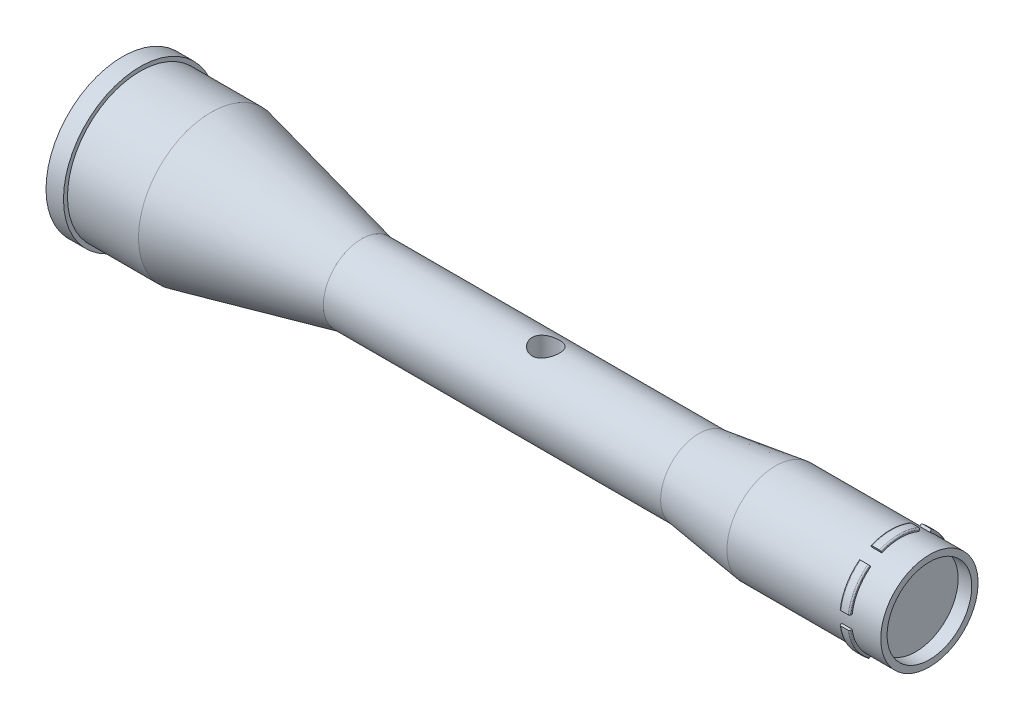
from build123d import *

# Parameters (mm, degrees)
BOSS_EXTRUDE1_DEPTH     = 3.73
FILLET1_R               = 0.5
FILLET2_R               = 0.5
FILLET3_R               = 0.5
FILLET4_R               = 0.5
FILLET5_R               = 0.5
FILLET6_R               = 0.5
CUT_EXTRUDE1_DEPTH      = 153.97340863692617
CUT_EXTRUDE1_DEPTH_BACK = 153.97340863692617
SKETCH3_R               = 5.000000000000001
SKETCH4_R               = 25.25
CUT_EXTRUDE2_DEPTH      = 5
SKETCH5_R               = 15.5
CUT_EXTRUDE3_DEPTH      = 5


with BuildPart() as part:
    # Sketch1 → Revolve1 (revolve)
    with BuildSketch(Plane(origin=(0, 0, 0), x_dir=(1, 0, 0), z_dir=(0, 1, 0)), mode=Mode.PRIVATE) as revolve1_sk:
        Polygon((-147.75, 0), (-147.75, 28.025), (-141.35, 28.025), (-141.35, 26.56), (-115.35000000000001, 26.56), (-60.19000000000001, 14), (63.309999999999974, 14.000000000000002), (91.40999999999998, 17.819999999999993), (147.75, 17.82), (147.75, 5.428e-14), align=None)
    revolve(revolve1_sk.sketch.rotate(Axis((-147.75, 0, 0), (1, 0, -1.8e-16)), 180), axis=Axis((-147.75, 0, 0), (1, 0, -1.8e-16)))

    # Sketch3 → Cut-Extrude1 (cut, two sides: drawn at the far end of the back side and taken through both)
    with BuildSketch(Plane(origin=(0, 0, 0), x_dir=(1, 0, 0), z_dir=(0, 1, 0)).offset(-CUT_EXTRUDE1_DEPTH_BACK)):
        with Locations(Location((7.269999999999978, 0, 0), (0, 0, 270))):
            Circle(SKETCH3_R)
    extrude(amount=CUT_EXTRUDE1_DEPTH + CUT_EXTRUDE1_DEPTH_BACK, mode=Mode.SUBTRACT)

    # Sketch4 → Cut-Extrude2 (cut)
    with BuildSketch(Plane.ZY.offset(147.75)):
        Circle(SKETCH4_R)
    extrude(amount=-CUT_EXTRUDE2_DEPTH, mode=Mode.SUBTRACT)

    # Sketch5 → Cut-Extrude3 (cut)
    with BuildSketch(Plane(origin=(147.75, 0, -2.714e-14), x_dir=(-1.8e-16, 0, -1), z_dir=(1, 0, -1.8e-16))):
        Circle(SKETCH5_R)
    extrude(amount=-CUT_EXTRUDE3_DEPTH, mode=Mode.SUBTRACT)

    # Sketch7 → Revolve3 (revolve)
    with BuildSketch(Plane.XY):
        with BuildLine():
            Line((-142.75, -25.25), (-142.75, 0))
            Line((-142.75, 0), (-152.75, -1.22e-15))
            ThreePointArc((-152.75, -1.22e-15), (-150.1589786763916, -13.579050960947162), (-142.75, -25.25))
        make_face()
    revolve(axis=Axis((-142.75, 0, 0), (-1, -1.2e-16, 0)))


with BuildPart() as body_2:
    # Sketch2 → Boss-Extrude1 (new body)
    with BuildSketch(Plane(origin=(137.10999999999999, 0, -2.519e-14), x_dir=(-1.8e-16, 0, -1), z_dir=(1, 0, -1.8e-16))):
        with BuildLine():
            ThreePointArc((-5.1781e-13, 17.819999999999943), (3.4765095383270386, 17.477593696785586), (6.819418764745691, 16.463533269351167))
            Line((6.8194187647459215, 16.46353326935107), (7.175314356845478, 17.32274123458662))
            ThreePointArc((7.175314356845478, 17.322741234586623), (3.6579435378024296, 18.389724007560574), (-8.5e-16, 18.750000000000004))
            Line((0, 18.75), (1.35e-15, 17.819999999999943))
        make_face()
        with BuildLine():
            Line((-7.175314356845417, 17.32274123458662), (-6.8194187647458655, 16.46353326935108))
            ThreePointArc((-6.81941876474563, 16.463533269351167), (-3.4765095383275177, 17.47759369678548), (-5.1781e-13, 17.819999999999943))
            Line((1.35e-15, 17.819999999999943), (0, 18.75))
            ThreePointArc((-8.5e-16, 18.750000000000004), (-3.657943537802398, 18.38972400756057), (-7.175314356845421, 17.322741234586623))
        make_face()
        with BuildLine():
            Line((11.414276793913524, 14.875375130460668), (10.848128664935379, 14.13755652398977))
            ThreePointArc((10.84812866493579, 14.137556523989462), (15.432572695438763, 8.909999999999819), (17.667547429681257, 2.325976745361456))
            Line((17.66754742968128, 2.325976745361297), (18.589591150758974, 2.4473661041259502))
            ThreePointArc((18.589591150758977, 2.447366104125951), (16.237976320958253, 9.375000000000002), (11.414276793913526, 14.875375130460673))
        make_face()
        with BuildLine():
            Line((18.589591150758974, -2.44736610412595), (17.667547429681278, -2.3259767453612956))
            ThreePointArc((17.667547429681257, -2.325976745361439), (15.432572695438765, -8.909999999999815), (10.848128664935782, -14.137556523989467))
            Line((10.84812866493539, -14.137556523989776), (11.414276793913531, -14.875375130460668))
            ThreePointArc((11.414276793913526, -14.875375130460673), (16.23797632095826, -9.374999999999995), (18.589591150758977, -2.447366104125953))
        make_face()
        with BuildLine():
            Line((7.175314356845473, -17.32274123458662), (6.81941876474592, -16.46353326935108))
            ThreePointArc((6.819418764745675, -16.46353326935117), (2.387e-14, -17.819999999999943), (-6.819418764745627, -16.46353326935117))
            Line((-6.8194187647458655, -16.46353326935107), (-7.175314356845422, -17.32274123458662))
            ThreePointArc((-7.175314356845417, -17.322741234586626), (2.37e-14, -18.750000000000004), (7.175314356845466, -17.322741234586626))
        make_face()
        with BuildLine():
            Line((-11.414276793913468, -14.875375130460672), (-10.848128664935322, -14.137556523989774))
            ThreePointArc((-10.848128664935746, -14.137556523989453), (-15.432572695438738, -8.90999999999977), (-17.66754742968121, -2.3259767453613542))
            Line((-17.66754742968121, -2.3259767453613005), (-18.58959115075892, -2.4473661041259565))
            ThreePointArc((-18.58959115075892, -2.4473661041259542), (-16.237976320958197, -9.375000000000004), (-11.414276793913466, -14.875375130460679))
        make_face()
        with BuildLine():
            Line((-18.58959115075892, 2.44736610412594), (-17.66754742968122, 2.325976745361286))
            ThreePointArc((-17.667547429681214, 2.3259767453613427), (-15.432572695438745, 8.909999999999759), (-10.84812866493575, 14.137556523989451))
            Line((-10.84812866493534, 14.137556523989767), (-11.414276793913483, 14.875375130460661))
            ThreePointArc((-11.414276793913487, 14.875375130460663), (-16.237976320958204, 9.374999999999993), (-18.589591150758924, 2.4473661041259427))
        make_face()
    extrude(amount=-BOSS_EXTRUDE1_DEPTH)

    # Fillet1
    fillet1_edges = [body_2.edges().sort_by_distance(p)[0] for p in [
        (137.10999999999999, 9.375000000000002, -16.23797632095828),
        (133.38, 9.375000000000002, -16.23797632095828),
    ]]
    fillet(fillet1_edges, radius=FILLET1_R)

    # Fillet2
    fillet2_edges = [body_2.edges().sort_by_distance(p)[0] for p in [
        (133.38, 18.750000000000007, -5.414e-14),
        (137.10999999999999, 18.750000000000007, -5.228e-14),
    ]]
    fillet(fillet2_edges, radius=FILLET2_R)

    # Fillet3
    fillet3_edges = [body_2.edges().sort_by_distance(p)[0] for p in [
        (137.10999999999999, 9.374999999999991, 16.23797632095818),
        (133.38, 9.374999999999991, 16.23797632095818),
    ]]
    fillet(fillet3_edges, radius=FILLET3_R)

    # Fillet4
    fillet4_edges = [body_2.edges().sort_by_distance(p)[0] for p in [
        (137.10999999999999, -9.375000000000007, 16.237976320958172),
        (133.38, -9.375000000000007, 16.237976320958172),
    ]]
    fillet(fillet4_edges, radius=FILLET4_R)

    # Fillet5
    fillet5_edges = [body_2.edges().sort_by_distance(p)[0] for p in [
        (137.10999999999999, -18.750000000000004, -4.517e-14),
        (133.38, -18.750000000000004, -4.449e-14),
    ]]
    fillet(fillet5_edges, radius=FILLET5_R)

    # Fillet6
    fillet6_edges = [body_2.edges().sort_by_distance(p)[0] for p in [
        (137.10999999999999, -9.375000000000005, -16.237976320958282),
        (133.38, -9.375000000000005, -16.237976320958282),
    ]]
    fillet(fillet6_edges, radius=FILLET6_R)


solid = Compound([part.part, body_2.part])
